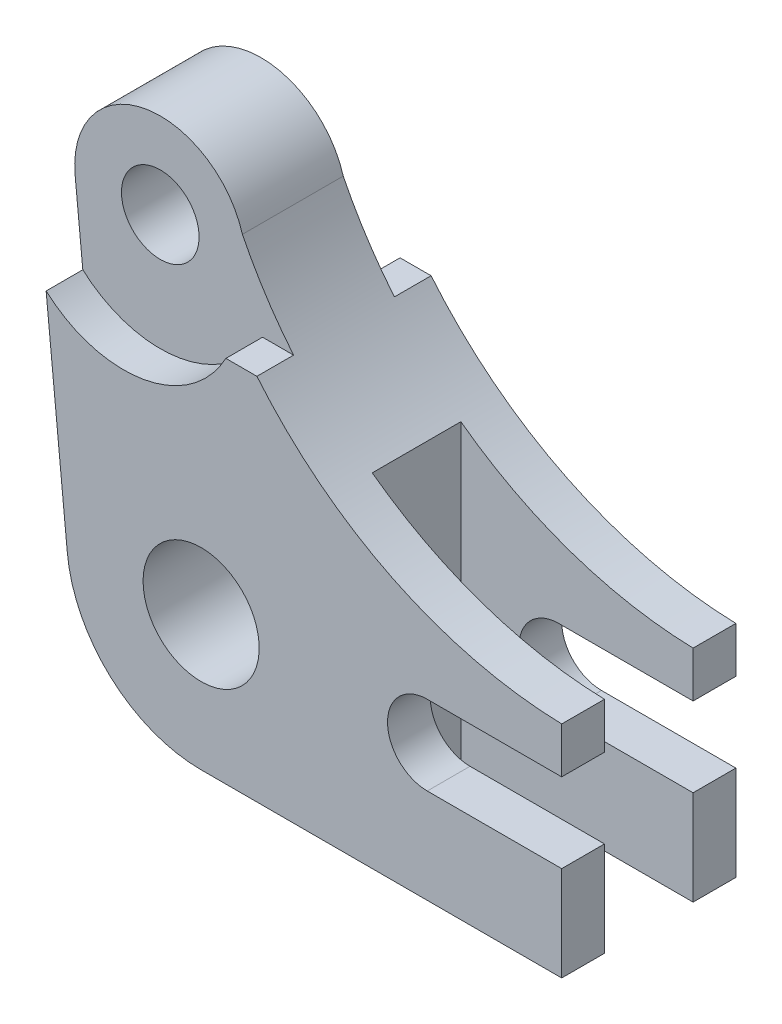
from build123d import *

# Parameters (mm, degrees)
ESQUISSE1_R             = 6.35
ESQUISSE1_R_2           = 9.5
BOSS_EXTRU_1_DEPTH      = 28.5
ENL_V_START             = -6
ENL_V_MAT_EXTRU_1_DEPTH = 6
ENL_V_MAT_EXTRU_2_DEPTH = 6
ESQUISSE4_W             = 38
ESQUISSE4_H             = 14.5
ENL_V_MAT_EXTRU_3_DEPTH = 124.584469767


with BuildPart() as part:
    # Esquisse1 → Boss.-Extru.1 (new body)
    with BuildSketch(Plane.XY):
        with BuildLine():
            Line((-86.633280406, -6.99307262), (-81.912918385, -55.104590809))
            ThreePointArc((-81.912918385, -55.104590809), (-74.795399572, -69.254576275), (-60.018047616, -74.956420883))
            Line((-60.018047616, -74.956420883), (-1.018047616, -74.956420883))
            Line((-1.018047616, -74.956420883), (-1.018047616, -59.456420883))
            Line((-1.018047616, -59.456420883), (-23.018047616, -59.456420883))
            ThreePointArc((-23.018047616, -59.456420883), (-29.518047616, -52.956420883), (-23.018047616, -46.456420883))
            Line((-23.018047616, -46.456420883), (-1.018047616, -46.456420883))
            Line((-1.018047616, -46.456420883), (-1.018047616, -38.956420883))
            ThreePointArc((-1.018047616, -38.956420883), (-35.318453229, -28.420111536), (-59.263146108, -1.695902984))
            ThreePointArc((-59.263146108, -1.695902984), (-75.360354059, 8.118888343), (-86.633280406, -6.99307262))
        make_face()
        with Locations(Location((-72.700180587, -5.626055331, 0), (0, 0, 180))):
            Circle(ESQUISSE1_R, mode=Mode.SUBTRACT)
        with Locations(Location((-60.018047616, -52.956420883, 0), (0, 0, 180))):
            Circle(ESQUISSE1_R_2, mode=Mode.SUBTRACT)
    extrude(amount=BOSS_EXTRU_1_DEPTH)

    # Esquisse2 → Enlèv. mat.-Extru.1 (cut)
    with BuildSketch(Plane.XY.offset(28.5).offset(ENL_V_START)):
        with BuildLine():
            Line((-50.888781824, -14.626055395), (-55.966980296, -14.626055395))
            ThreePointArc((-55.966980296, -14.626055395), (-69.422632675, -24.341227799), (-85.379019392, -19.776922952))
            Line((-85.379019392, -19.776922952), (-86.633280406, -6.99307262))
            ThreePointArc((-86.633280406, -6.99307262), (-75.360354059, 8.118888343), (-59.263146108, -1.695902984))
            ThreePointArc((-59.263146108, -1.695902984), (-55.448825079, -8.402467045), (-50.888781824, -14.626055395))
        make_face()
    extrude(amount=ENL_V_MAT_EXTRU_1_DEPTH, mode=Mode.SUBTRACT)

    # Esquisse3 → Enlèv. mat.-Extru.2 (cut)
    with BuildSketch(Plane(origin=(0, 0, 0), x_dir=(-1, 0, 0), z_dir=(0, 0, -1))):
        with BuildLine():
            Line((85.379019392, -19.776922952), (86.633280406, -6.99307262))
            ThreePointArc((86.633280406, -6.99307262), (75.360354059, 8.118888343), (59.263146108, -1.695902984))
            ThreePointArc((59.263146108, -1.695902984), (55.448825079, -8.402467045), (50.888781824, -14.626055395))
            Line((50.888781824, -14.626055395), (55.966980296, -14.626055395))
            ThreePointArc((55.966980296, -14.626055395), (69.422632675, -24.341227799), (85.379019392, -19.776922952))
        make_face()
    extrude(amount=-ENL_V_MAT_EXTRU_2_DEPTH, mode=Mode.SUBTRACT)

    # Esquisse4 → Enlèv. mat.-Extru.3 (cut, through all)
    with BuildSketch(Plane.XZ.offset(74.956420883)):
        with Locations((-20.018047616, 14.25)):
            Rectangle(ESQUISSE4_W, ESQUISSE4_H)
    extrude(amount=-ENL_V_MAT_EXTRU_3_DEPTH, mode=Mode.SUBTRACT)


solid = part.part
